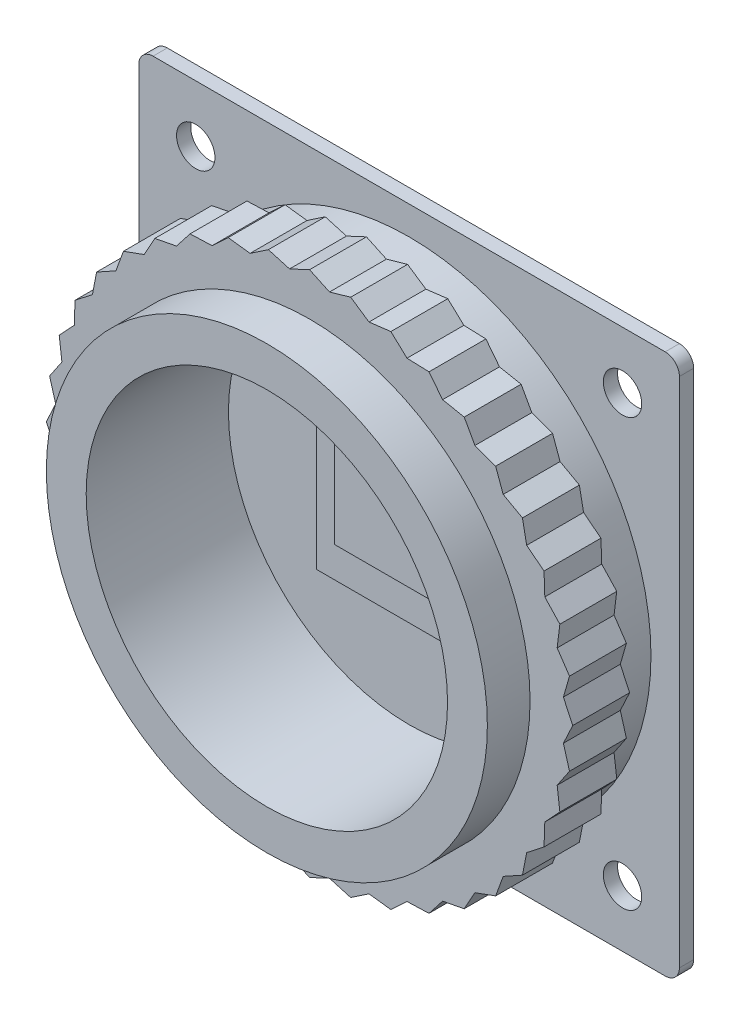
from build123d import *

# Parameters (mm, degrees)
PCB_DEPTH           = 1
SKETCH2_W           = 11
SKETCH2_H           = 11
SENSOR_DEPTH        = 1
SKETCH3_W           = 7.9
SKETCH3_H           = 6.1
SENSOR_GLASS_DEPTH  = 0.3
SKETCH4_R           = 17
SKETCH4_R_2         = 12.7
MOUNT_BASE_DEPTH    = 3
SKETCH5_R           = 12.7
LOCK_RING_DEPTH     = 4
SKETCH6_R           = 15.5
SKETCH6_R_2         = 12.7
CS_TUBE_DEPTH       = 3
SKETCH7_W           = 21
SKETCH7_H           = 5.5
FFC_CONNECTOR_DEPTH = 2.5
SKETCH8_R           = 1.35
HOLES_DEPTH         = 1


with BuildPart() as part:
    # Sketch1 → PCB (new body)
    with BuildSketch(Plane.XY):
        with BuildLine():
            Line((1, 0), (37, 0))
            ThreePointArc((37, 0), (37.707106781, 0.292893219), (38, 1))
            Line((38, 1), (38, 37))
            ThreePointArc((38, 37), (37.707106781, 37.707106781), (37, 38))
            Line((37, 38), (1, 38))
            ThreePointArc((1, 38), (0.292893219, 37.707106781), (0, 37))
            Line((0, 37), (0, 1))
            ThreePointArc((0, 1), (0.292893219, 0.292893219), (1, 0))
        make_face()
    extrude(amount=PCB_DEPTH)

    # Sketch2 → Sensor (add)
    with BuildSketch(Plane.XY.offset(1)):
        with Locations((19, 19)):
            Rectangle(SKETCH2_W, SKETCH2_H)
    extrude(amount=SENSOR_DEPTH)

    # Sketch3 → Sensor_glass (add)
    with BuildSketch(Plane.XY.offset(2)):
        with Locations((19, 19)):
            Rectangle(SKETCH3_W, SKETCH3_H)
    extrude(amount=SENSOR_GLASS_DEPTH)

    # Sketch4 → Mount_base (add)
    with BuildSketch(Plane.XY.offset(1)):
        with Locations((19, 19)):
            Circle(SKETCH4_R)
        with Locations((19, 19)):
            Circle(SKETCH4_R_2, mode=Mode.SUBTRACT)
    extrude(amount=MOUNT_BASE_DEPTH)

    # Sketch5 → Lock_ring (add)
    with BuildSketch(Plane.XY.offset(4)):
        Polygon((37.5, 19), (36.844820274, 20.404417814), (37.272234301, 21.894037603), (36.405421575, 23.178672013), (36.594545551, 24.716814396), (35.537443632, 25.850033439), (35.483620697, 27.398824245), (34.262258942, 28.352724308), (33.966814396, 29.874027167), (32.611266784, 30.625120065), (32.081475452, 32.081475452), (30.625120065, 32.611266784), (29.874027167, 33.966814396), (28.352724308, 34.262258942), (27.398824245, 35.483620697), (25.850033439, 35.537443632), (24.716814396, 36.594545551), (23.178672013, 36.405421575), (21.894037603, 37.272234301), (20.404417814, 36.844820274), (19, 37.5), (17.595582186, 36.844820274), (16.105962397, 37.272234301), (14.821327987, 36.405421575), (13.283185604, 36.594545551), (12.149966561, 35.537443632), (10.601175755, 35.483620697), (9.647275692, 34.262258942), (8.125972833, 33.966814396), (7.374879935, 32.611266784), (5.918524548, 32.081475452), (5.388733216, 30.625120065), (4.033185604, 29.874027167), (3.737741058, 28.352724308), (2.516379303, 27.398824245), (2.462556368, 25.850033439), (1.405454449, 24.716814396), (1.594578425, 23.178672013), (0.727765699, 21.894037603), (1.155179726, 20.404417814), (0.5, 19), (1.155179726, 17.595582186), (0.727765699, 16.105962397), (1.594578425, 14.821327987), (1.405454449, 13.283185604), (2.462556368, 12.149966561), (2.516379303, 10.601175755), (3.737741058, 9.647275692), (4.033185604, 8.125972833), (5.388733216, 7.374879935), (5.918524548, 5.918524548), (7.374879935, 5.388733216), (8.125972833, 4.033185604), (9.647275692, 3.737741058), (10.601175755, 2.516379303), (12.149966561, 2.462556368), (13.283185604, 1.405454449), (14.821327987, 1.594578425), (16.105962397, 0.727765699), (17.595582186, 1.155179726), (19, 0.5), (20.404417814, 1.155179726), (21.894037603, 0.727765699), (23.178672013, 1.594578425), (24.716814396, 1.405454449), (25.850033439, 2.462556368), (27.398824245, 2.516379303), (28.352724308, 3.737741058), (29.874027167, 4.033185604), (30.625120065, 5.388733216), (32.081475452, 5.918524548), (32.611266784, 7.374879935), (33.966814396, 8.125972833), (34.262258942, 9.647275692), (35.483620697, 10.601175755), (35.537443632, 12.149966561), (36.594545551, 13.283185604), (36.405421575, 14.821327987), (37.272234301, 16.105962397), (36.844820274, 17.595582186), align=None)
        with Locations((19, 19)):
            Circle(SKETCH5_R, mode=Mode.SUBTRACT)
    extrude(amount=LOCK_RING_DEPTH)

    # Sketch6 → CS_tube (add)
    with BuildSketch(Plane.XY.offset(8)):
        with Locations((19, 19)):
            Circle(SKETCH6_R)
        with Locations((19, 19)):
            Circle(SKETCH6_R_2, mode=Mode.SUBTRACT)
    extrude(amount=CS_TUBE_DEPTH)

    # Sketch7 → FFC_connector (add)
    with BuildSketch(Plane.XY):
        with Locations((19, 3.5)):
            Rectangle(SKETCH7_W, SKETCH7_H)
    extrude(amount=-FFC_CONNECTOR_DEPTH)

    # Sketch8 → Holes (cut)
    with BuildSketch(Plane.XY.offset(1)):
        with Locations((4, 4)):
            Circle(SKETCH8_R)
        with Locations((4, 34)):
            Circle(SKETCH8_R)
        with Locations((34, 4)):
            Circle(SKETCH8_R)
        with Locations((34, 34)):
            Circle(SKETCH8_R)
    extrude(amount=-HOLES_DEPTH, mode=Mode.SUBTRACT)


solid = part.part
